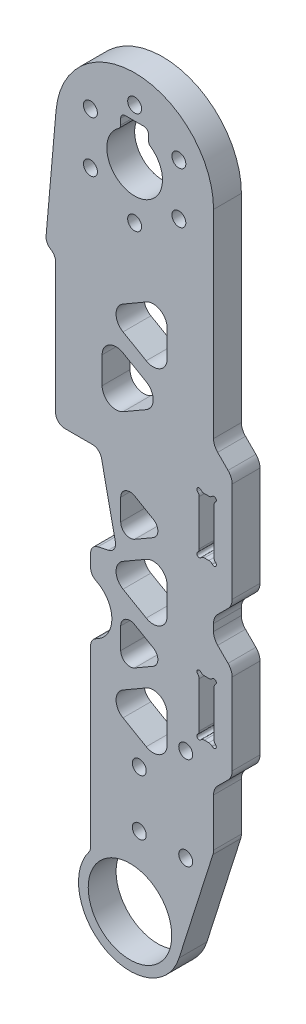
from build123d import *

# Parameters (mm, degrees)
SKETCH_1_R      = 1.5
SKETCH_1_R_2    = 9
EXTRUDE_1_DEPTH = 6


with BuildPart() as part:
    # 草图1 → 凸台-拉伸1 (new body)
    with BuildSketch(Plane(origin=(0, 0, 0), x_dir=(-1, 0, 0), z_dir=(0, 0, -1))):
        with BuildLine():
            Line((32.955703333, 66.620894067), (30.80974204, 91.149343878))
            ThreePointArc((30.80974204, 91.149343878), (13.132902588, 106.651516018), (-3.125567827, 89.667696251))
            Line((-3.125567827, 89.667696251), (-3.125567827, 46.910336938))
            ThreePointArc((-3.125567827, 46.910336938), (-3.35392923, 45.762286641), (-4.004247484, 44.789016595))
            Line((-4.004247484, 44.789016595), (-6.246888171, 42.546375908))
            ThreePointArc((-6.246888171, 42.546375908), (-6.897206425, 41.573105861), (-7.125567827, 40.425055564))
            Line((-7.125567827, 40.425055564), (-7.125567827, 18.910336938))
            ThreePointArc((-7.125567827, 18.910336938), (-6.897206425, 17.762286641), (-6.246888171, 16.789016595))
            Line((-6.246888171, 16.789016595), (-4.004247484, 14.546375908))
            ThreePointArc((-4.004247484, 14.546375908), (-3.35392923, 13.573105861), (-3.125567827, 12.425055564))
            Line((-3.125567827, 12.425055564), (-3.125567827, 10.910336938))
            ThreePointArc((-3.125567827, 10.910336938), (-3.35392923, 9.762286641), (-4.004247484, 8.789016595))
            Line((-4.004247484, 8.789016595), (-6.246888171, 6.546375908))
            ThreePointArc((-6.246888171, 6.546375908), (-6.897206425, 5.573105861), (-7.125567827, 4.425055564))
            Line((-7.125567827, 4.425055564), (-7.125567827, -13.089663062))
            ThreePointArc((-7.125567827, -13.089663062), (-6.897206425, -14.237713359), (-6.246888171, -15.210983405))
            Line((-6.246888171, -15.210983405), (-4.004247484, -17.453624092))
            ThreePointArc((-4.004247484, -17.453624092), (-3.35392923, -18.426894139), (-3.125567827, -19.574944436))
            Line((-3.125567827, -19.574944436), (-3.125567827, -29.86687526))
            ThreePointArc((-3.125567827, -29.86687526), (-3.090102825, -30.326801608), (-2.98454633, -30.775853763))
            Line((-2.98454633, -30.775853763), (4.301916011, -53.693710595))
            ThreePointArc((4.301916011, -53.693710595), (19.95472423, -60.194746986), (23.749643638, -43.67589515))
            ThreePointArc((23.749643638, -43.67589515), (23.452277042, -43.108350682), (23.349643638, -42.47589515))
            Line((23.349643638, -42.47589515), (23.349643638, -4.902719504))
            ThreePointArc((23.349643638, -4.902719504), (23.040438051, -3.834443205), (22.208429387, -3.096483906))
            ThreePointArc((22.208429387, -3.096483906), (18.784786633, 2.32222289), (22.208429387, 7.740929686))
            ThreePointArc((22.208429387, 7.740929686), (23.040438051, 8.478888986), (23.349643638, 9.547165285))
            Line((23.349643638, 9.547165285), (23.349643638, 12.31993364))
            ThreePointArc((23.349643638, 12.31993364), (22.903935561, 13.578574422), (21.765467019, 14.276228841))
            Line((21.765467019, 14.276228841), (19.563528405, 14.744265342))
            ThreePointArc((19.563528405, 14.744265342), (18.30201065, 15.611282474), (18.023056585, 17.116383925))
            Line((18.023056585, 17.116383925), (21.012916503, 31.182568919))
            ThreePointArc((21.012916503, 31.182568919), (21.710570922, 32.32103746), (22.969211704, 32.766745537))
            Line((22.969211704, 32.766745537), (28.907131585, 32.766745537))
            ThreePointArc((28.907131585, 32.766745537), (30.321345148, 33.352531975), (30.907131585, 34.766745537))
            Line((30.907131585, 34.766745537), (30.907131585, 62.915918647))
            ThreePointArc((30.907131585, 62.915918647), (31.129655766, 63.83274999), (31.747711296, 64.545564189))
            ThreePointArc((31.747711296, 64.545564189), (31.948812633, 64.689858135), (32.148749116, 64.835761848))
            ThreePointArc((32.148749116, 64.835761848), (32.785761883, 65.622760099), (32.955703333, 66.620894067))
        make_face()
        with Locations((13.874432173, 100.667696251)):
            Circle(SKETCH_1_R, mode=Mode.SUBTRACT)
        with Locations((4.348152731, 95.167696251)):
            Circle(SKETCH_1_R, mode=Mode.SUBTRACT)
        with Locations((4.348152731, 84.167696251)):
            Circle(SKETCH_1_R, mode=Mode.SUBTRACT)
        with Locations((13.874432173, 78.667696251)):
            Circle(SKETCH_1_R, mode=Mode.SUBTRACT)
        with Locations((23.400711614, 84.167696251)):
            Circle(SKETCH_1_R, mode=Mode.SUBTRACT)
        with Locations((12.874432173, -22.332303749)):
            Circle(SKETCH_1_R, mode=Mode.SUBTRACT)
        with Locations((2.874432173, -14.332303749)):
            Circle(SKETCH_1_R, mode=Mode.SUBTRACT)
        with Locations((12.874432173, -34.332303749)):
            Circle(SKETCH_1_R, mode=Mode.SUBTRACT)
        with Locations((2.874432173, -34.332303749)):
            Circle(SKETCH_1_R, mode=Mode.SUBTRACT)
        with Locations((14.874432173, -50.332303749)):
            Circle(SKETCH_1_R_2, mode=Mode.SUBTRACT)
        with Locations((23.400711614, 95.167696251)):
            Circle(SKETCH_1_R, mode=Mode.SUBTRACT)
        with BuildLine():
            Line((-2.107533838, 35.667696251), (-1.143601816, 35.667696251))
            ThreePointArc((-1.143601816, 35.667696251), (-0.735353525, 35.754825322), (-0.398245823, 36.001029585))
            ThreePointArc((-0.398245823, 36.001029585), (0.327985563, 36.021249642), (0.307765506, 35.295018255))
            ThreePointArc((0.307765506, 35.295018255), (0.061561244, 34.957910553), (-0.025567827, 34.549662262))
            Line((-0.025567827, 34.549662262), (-0.025567827, 24.78573024))
            ThreePointArc((-0.025567827, 24.78573024), (0.061561244, 24.377481949), (0.307765506, 24.040374247))
            ThreePointArc((0.307765506, 24.040374247), (0.327985563, 23.314142861), (-0.398245823, 23.334362918))
            ThreePointArc((-0.398245823, 23.334362918), (-0.735353525, 23.58056718), (-1.143601816, 23.667696251))
            Line((-1.143601816, 23.667696251), (-2.107533838, 23.667696251))
            ThreePointArc((-2.107533838, 23.667696251), (-2.515782129, 23.58056718), (-2.852889831, 23.334362918))
            ThreePointArc((-2.852889831, 23.334362918), (-3.579121218, 23.314142861), (-3.558901161, 24.040374247))
            ThreePointArc((-3.558901161, 24.040374247), (-3.312696898, 24.377481949), (-3.225567827, 24.78573024))
            Line((-3.225567827, 24.78573024), (-3.225567827, 34.549662262))
            ThreePointArc((-3.225567827, 34.549662262), (-3.312696898, 34.957910553), (-3.558901161, 35.295018255))
            ThreePointArc((-3.558901161, 35.295018255), (-3.579121218, 36.021249642), (-2.852889831, 36.001029585))
            ThreePointArc((-2.852889831, 36.001029585), (-2.515782129, 35.754825322), (-2.107533838, 35.667696251))
        make_face(mode=Mode.SUBTRACT)
        with BuildLine():
            Line((10.874432173, 95.412258898), (10.874432173, 96.667696251))
            ThreePointArc((10.874432173, 96.667696251), (11.167325392, 97.374803032), (11.874432173, 97.667696251))
            Line((11.874432173, 97.667696251), (15.874432173, 97.667696251))
            ThreePointArc((15.874432173, 97.667696251), (16.581538954, 97.374803032), (16.874432173, 96.667696251))
            Line((16.874432173, 96.667696251), (16.874432173, 95.412258898))
            ThreePointArc((16.874432173, 95.412258898), (16.988026912, 94.949348848), (17.303003601, 94.591607091))
            ThreePointArc((17.303003601, 94.591607091), (13.874432173, 83.667696251), (10.445860744, 94.591607091))
            ThreePointArc((10.445860744, 94.591607091), (10.760837433, 94.949348848), (10.874432173, 95.412258898))
        make_face(mode=Mode.SUBTRACT)
        with BuildLine():
            Line((11.374432172, 65.152523811), (16.374432175, 62.265772463))
            ThreePointArc((16.374432175, 62.265772463), (17.874432175, 59.667696252), (16.374432175, 57.06962004))
            Line((16.374432175, 57.06962004), (11.374432172, 54.182868693))
            ThreePointArc((11.374432172, 54.182868693), (8.374432172, 54.182868693), (6.874432172, 56.780944904))
            Line((6.874432172, 56.780944904), (6.874432172, 62.5544476))
            ThreePointArc((6.874432172, 62.5544476), (8.374432172, 65.152523811), (11.374432172, 65.152523811))
        make_face(mode=Mode.SUBTRACT)
        with BuildLine():
            Line((6.874432172, 8.780944893), (6.874432172, 14.554447588))
            ThreePointArc((6.874432172, 14.554447588), (8.374432172, 17.1525238), (11.374432172, 17.1525238))
            Line((11.374432172, 17.1525238), (16.374432175, 14.265772452))
            ThreePointArc((16.374432175, 14.265772452), (17.874432175, 11.66769624), (16.374432175, 9.069620029))
            Line((16.374432175, 9.069620029), (11.374432172, 6.182868681))
            ThreePointArc((11.374432172, 6.182868681), (8.374432172, 6.182868681), (6.874432172, 8.780944893))
        make_face(mode=Mode.SUBTRACT)
        with BuildLine():
            Line((13.874432173, -4.373755645), (9.874432172, -2.064354567))
            ThreePointArc((9.874432172, -2.064354567), (8.874432172, -0.33230376), (9.874432172, 1.399747048))
            Line((9.874432172, 1.399747048), (13.874432173, 3.709148125))
            ThreePointArc((13.874432173, 3.709148125), (15.874432173, 3.709148125), (16.874432173, 1.977097318))
            Line((16.874432173, 1.977097318), (16.874432173, -2.641704837))
            ThreePointArc((16.874432173, -2.641704837), (15.874432173, -4.373755645), (13.874432173, -4.373755645))
        make_face(mode=Mode.SUBTRACT)
        with BuildLine():
            Line((6.874432172, -15.219055113), (6.874432172, -9.445552417))
            ThreePointArc((6.874432172, -9.445552417), (8.374432172, -6.847476206), (11.374432172, -6.847476206))
            Line((11.374432172, -6.847476206), (16.374432175, -9.734227554))
            ThreePointArc((16.374432175, -9.734227554), (17.874432175, -12.332303765), (16.374432175, -14.930379977))
            Line((16.374432175, -14.930379977), (11.374432172, -17.817131325))
            ThreePointArc((11.374432172, -17.817131325), (8.374432172, -17.817131325), (6.874432172, -15.219055113))
        make_face(mode=Mode.SUBTRACT)
        with BuildLine():
            Line((9.874432172, 25.399747048), (13.874432173, 27.709148125))
            ThreePointArc((13.874432173, 27.709148125), (15.874432173, 27.709148125), (16.874432173, 25.977097318))
            Line((16.874432173, 25.977097318), (16.874432173, 21.358295163))
            ThreePointArc((16.874432173, 21.358295163), (15.874432173, 19.626244355), (13.874432173, 19.626244355))
            Line((13.874432173, 19.626244355), (9.874432172, 21.935645433))
            ThreePointArc((9.874432172, 21.935645433), (8.874432172, 23.66769624), (9.874432172, 25.399747048))
        make_face(mode=Mode.SUBTRACT)
        with BuildLine():
            Line((20.874432175, 50.554447597), (20.874432175, 44.780944901))
            ThreePointArc((20.874432175, 44.780944901), (19.374432175, 42.18286869), (16.374432175, 42.18286869))
            Line((16.374432175, 42.18286869), (11.374432172, 45.069620038))
            ThreePointArc((11.374432172, 45.069620038), (9.874432172, 47.667696249), (11.374432172, 50.26577246))
            Line((11.374432172, 50.26577246), (16.374432175, 53.152523808))
            ThreePointArc((16.374432175, 53.152523808), (19.374432175, 53.152523808), (20.874432175, 50.554447597))
        make_face(mode=Mode.SUBTRACT)
        with BuildLine():
            Line((-3.225567827, -9.21426976), (-3.225567827, 0.549662262))
            ThreePointArc((-3.225567827, 0.549662262), (-3.312696898, 0.957910553), (-3.558901161, 1.295018255))
            ThreePointArc((-3.558901161, 1.295018255), (-3.579121218, 2.021249642), (-2.852889831, 2.001029585))
            ThreePointArc((-2.852889831, 2.001029585), (-2.515782129, 1.754825322), (-2.107533838, 1.667696251))
            Line((-2.107533838, 1.667696251), (-1.143601816, 1.667696251))
            ThreePointArc((-1.143601816, 1.667696251), (-0.735353525, 1.754825322), (-0.398245823, 2.001029585))
            ThreePointArc((-0.398245823, 2.001029585), (0.327985563, 2.021249642), (0.307765506, 1.295018255))
            ThreePointArc((0.307765506, 1.295018255), (0.061561244, 0.957910553), (-0.025567827, 0.549662262))
            Line((-0.025567827, 0.549662262), (-0.025567827, -9.21426976))
            ThreePointArc((-0.025567827, -9.21426976), (0.061561244, -9.622518051), (0.307765506, -9.959625753))
            ThreePointArc((0.307765506, -9.959625753), (0.327985563, -10.685857139), (-0.398245823, -10.665637082))
            ThreePointArc((-0.398245823, -10.665637082), (-0.735353525, -10.41943282), (-1.143601816, -10.332303749))
            Line((-1.143601816, -10.332303749), (-2.107533838, -10.332303749))
            ThreePointArc((-2.107533838, -10.332303749), (-2.515782129, -10.41943282), (-2.852889831, -10.665637082))
            ThreePointArc((-2.852889831, -10.665637082), (-3.579121218, -10.685857139), (-3.558901161, -9.959625753))
            ThreePointArc((-3.558901161, -9.959625753), (-3.312696898, -9.622518051), (-3.225567827, -9.21426976))
        make_face(mode=Mode.SUBTRACT)
    extrude(amount=-EXTRUDE_1_DEPTH)


solid = part.part
